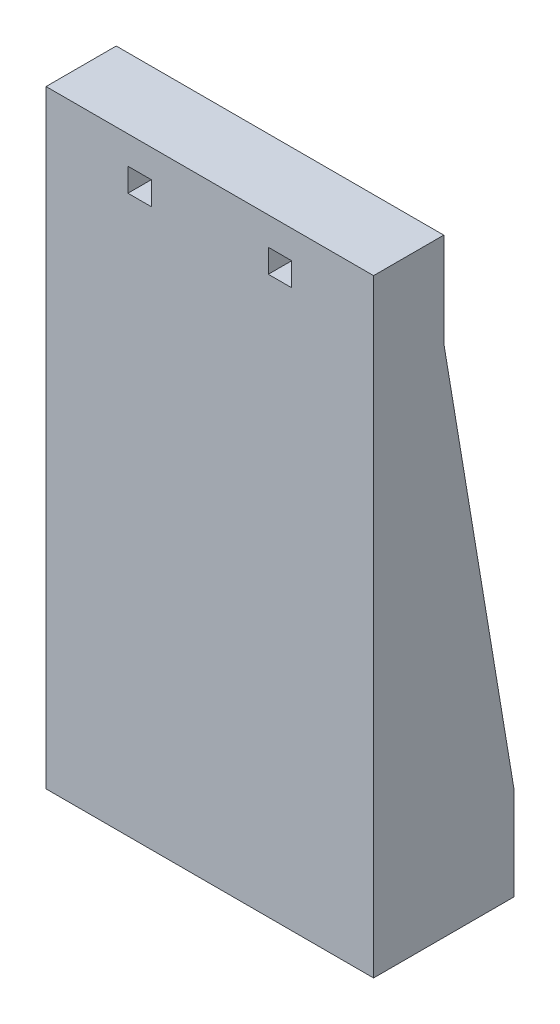
from build123d import *

# Parameters (mm, degrees)
SKETCH1_W           = 5
SKETCH1_H           = 110
SKETCH1_W_2         = 30
SKETCH1_H_2         = 20
BOSS_EXTRUDE1_DEPTH = 35
SKETCH9_W           = 10
SKETCH9_H           = 20
BOSS_EXTRUDE2_DEPTH = 70
RIB1_REACH          = 141.732
SKETCH10_WALL_W     = 372.705210204
SKETCH10_WALL_H     = 4
SKETCH11_W          = 5
SKETCH11_H          = 5
CUT_EXTRUDE2_DEPTH  = 10


with BuildPart() as part:
    # Sketch1 → Boss-Extrude1 (new, symmetric)
    with BuildSketch(Plane(origin=(0, 0, 0), x_dir=(0, 0, -1), z_dir=(1, 0, 0))):
        with Locations((-12.5, 65)):
            Rectangle(SKETCH1_W, SKETCH1_H)
        Rectangle(SKETCH1_W_2, SKETCH1_H_2)
    extrude(amount=BOSS_EXTRUDE1_DEPTH, both=True)

    # Sketch9 → Boss-Extrude2 (add, through all)
    with BuildSketch(Plane(origin=(35, 0, 0), x_dir=(0, 0, -1), z_dir=(1, 0, 0))):
        with Locations((-5, 110)):
            Rectangle(SKETCH9_W, SKETCH9_H)
    extrude(amount=-BOSS_EXTRUDE2_DEPTH)

    # Sketch10 wall → Rib1 (add, up to next)
    with BuildSketch(Plane(origin=(35, 55, -7.5), x_dir=(0, -0.986393923832, -0.164398987305), z_dir=(0, 0.164398987305, -0.986393923832)), mode=Mode.PRIVATE) as rib1_sk1:
        with Locations((0, 2)):
            Rectangle(SKETCH10_WALL_W, SKETCH10_WALL_H)
    rib1_tool1 = extrude(rib1_sk1.sketch, amount=-RIB1_REACH, mode=Mode.PRIVATE) - part.part
    rib1 = rib1_tool1.solids().sort_by_distance((35, 55, -7.5))[0]
    add(rib1)

    # Mirror1: Rib1 across plane
    add(rib1.mirror(Plane(origin=(0, 0, 0), x_dir=(0, 0, 1), z_dir=(1, 0, 0))))

    # Sketch11 → Cut-Extrude2 (cut)
    with BuildSketch(Plane.XY.offset(15)):
        with Locations((15, 111.5)):
            Rectangle(SKETCH11_W, SKETCH11_H)
        with Locations((-15, 111.5)):
            Rectangle(SKETCH11_W, SKETCH11_H)
    extrude(amount=-CUT_EXTRUDE2_DEPTH, mode=Mode.SUBTRACT)


solid = part.part
